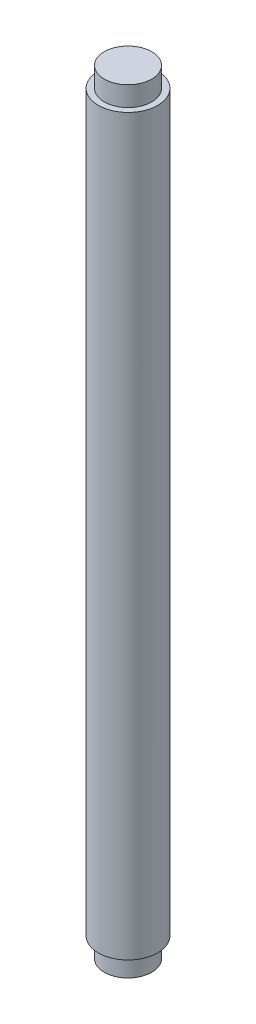
from build123d import *

# Parameters (mm, degrees)
SKETCH1_R                        = 15
BOSS_EXTRUDE1_DEPTH              = 195.5
SKETCH2_OUTSIDE_W                = 110.66
SKETCH2_OUTSIDE_H                = 110.66
SKETCH2_OUTSIDE_R                = 12
CUT_EXTRUDE1_DEPTH               = 10
F_13_5_13_5_DIAMETER_HOLE1_D     = 13.5
F_13_5_13_5_DIAMETER_HOLE1_DEPTH = 2
F_13_5_13_5_DIAMETER_HOLE1_TIP   = 4.055809178


with BuildPart() as part:
    # Sketch1 → Boss-Extrude1 (new, symmetric)
    with BuildSketch(Plane(origin=(0, 0, 0), x_dir=(1, 0, 0), z_dir=(0, 1, 0))):
        with Locations(Location((0, 0, 0), (0, 0, 270))):
            Circle(SKETCH1_R)
    extrude(amount=BOSS_EXTRUDE1_DEPTH, both=True)

    # Sketch2 outside → Cut-Extrude1 (cut)
    with BuildSketch(Plane(origin=(0, 195.5, 0), x_dir=(1, 0, 0), z_dir=(0, 1, 0))):
        Rectangle(SKETCH2_OUTSIDE_W, SKETCH2_OUTSIDE_H)
        with Locations(Location((0, 0, 0), (0, 0, 270))):
            Circle(SKETCH2_OUTSIDE_R, mode=Mode.SUBTRACT)
    cut_extrude1 = extrude(amount=-CUT_EXTRUDE1_DEPTH, mode=Mode.SUBTRACT)

    # Mirror1: Cut-Extrude1 across plane
    add(cut_extrude1.mirror(Plane.ZX), mode=Mode.SUBTRACT)

    # Ø13.5 (13.5) Diameter Hole1
    with Locations(Plane(origin=(0, -195.5, 0), x_dir=(-1, 0, 0), z_dir=(0, -1, 0))):
        with Locations((0, 0)):
            Hole(F_13_5_13_5_DIAMETER_HOLE1_D / 2, depth=F_13_5_13_5_DIAMETER_HOLE1_DEPTH)
            with Locations((0, 0, -(F_13_5_13_5_DIAMETER_HOLE1_DEPTH + F_13_5_13_5_DIAMETER_HOLE1_TIP / 2))):  # 118° drill point
                Cone(0, F_13_5_13_5_DIAMETER_HOLE1_D / 2, F_13_5_13_5_DIAMETER_HOLE1_TIP, mode=Mode.SUBTRACT)


solid = part.part
